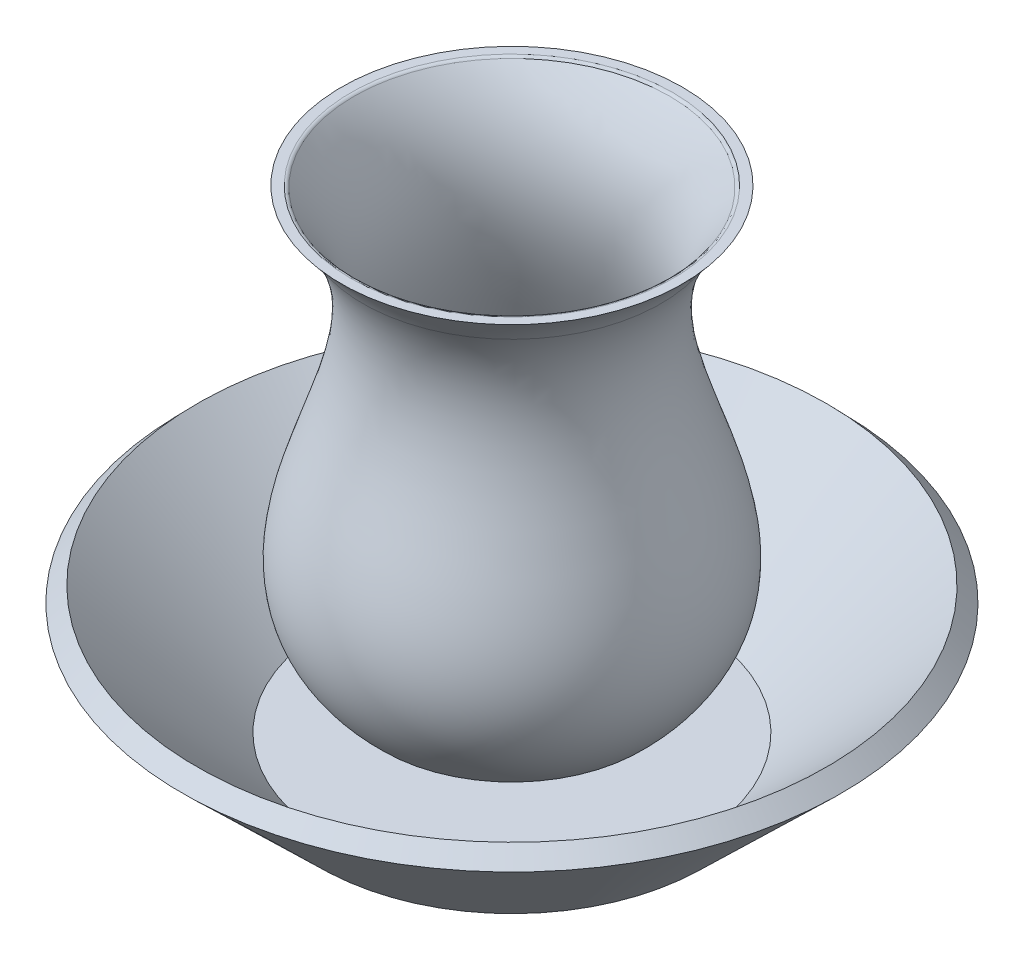
from build123d import *

# Parameters (mm, degrees)
SHELL26_T = -2
FILLET1_R = 1


with BuildPart() as part:
    # Sketch1 → Revolve2 (revolve)
    with BuildSketch(Plane.XY):
        with BuildLine():
            Line((40, 100), (0, 100))
            Line((0, 100), (0, 0))
            Line((0, 0), (30, 0))
            add(Edge.make_bspline(
                [(40, 100), (8.214298289, 65.676365866), (63.629973381, 31.703163026), (30, 0)],
                knots=[0, 0, 0, 0, 1, 1, 1, 1], degree=3))
        make_face()
    revolve(axis=Axis((0, 0, 0), (0, 1, 0)))

    # Shell26
    shell26_openings = [part.faces().sort_by_distance(p)[0] for p in [
        (0, 100, 0),
    ]]
    offset(amount=SHELL26_T, openings=shell26_openings, kind=Kind.INTERSECTION)

    # Fillet1
    fillet1_edges = [part.edges().sort_by_distance(p)[0] for p in [
        (-37.317425183, 100, 0),
        (-29.196581379, 2, 0),
    ]]
    fillet(fillet1_edges, radius=FILLET1_R)


with BuildPart() as body_2:
    # Sketch7 → Revolve-Thin2 (revolve)
    with BuildSketch(Plane.XY, mode=Mode.PRIVATE) as revolve_thin2_sk:
        Polygon((0, -16.125168338), (-45, -16.125168338), (-77.321781883, 15.184613135), (-73.842917275, 18.775922233), (-42.975358255, -11.125168338), (0, -11.125168338), align=None)
    revolve(revolve_thin2_sk.sketch.rotate(Axis((0, -16.125168338, 0), (0, 1, 0)), 270), axis=Axis((0, -16.125168338, 0), (0, 1, 0)))


solid = Compound([part.part, body_2.part])
